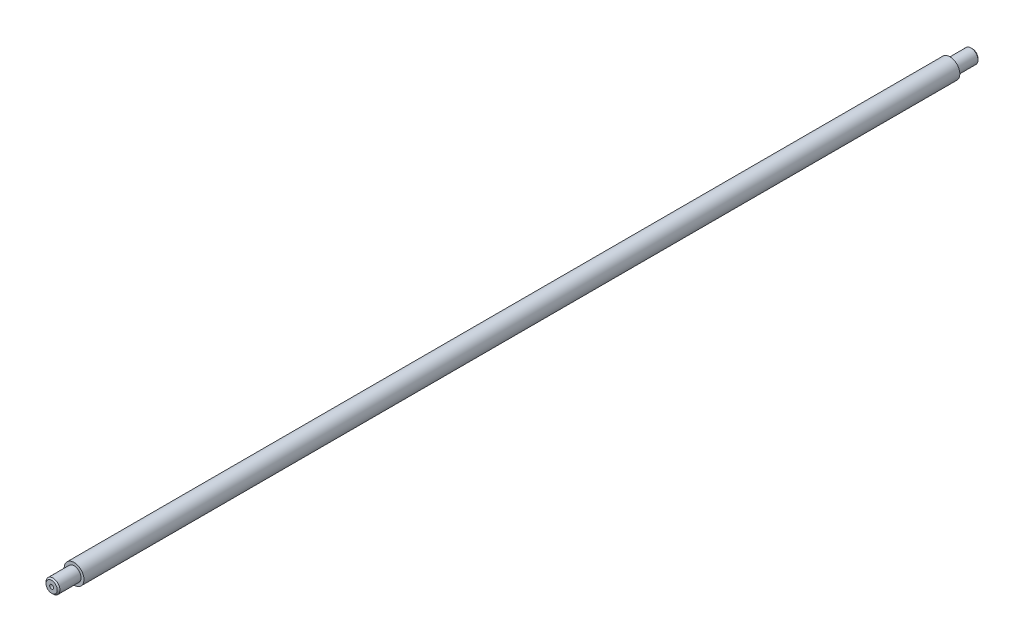
from build123d import *

# Parameters (mm, degrees)
SKETCH2_R           = 5.588
BOSS_EXTRUDE1_DEPTH = 247.65
SKETCH3_R           = 3.937
BOSS_EXTRUDE2_DEPTH = 12.7
BOSS_EXTRUDE3_START = 12.7
SKETCH4_R           = 3.937
BOSS_EXTRUDE3_DEPTH = 12.7
SKETCH5_R           = 1.143
CUT_EXTRUDE1_DEPTH  = 25.4
CUT_EXTRUDE2_START  = -25.4
SKETCH6_R           = 1.143
CUT_EXTRUDE2_DEPTH  = 25.4
CHAMFER2_SIZE       = 0.762


with BuildPart() as part:
    # Sketch2 → Boss-Extrude1 (new, symmetric)
    with BuildSketch(Plane.XY):
        Circle(SKETCH2_R)
    extrude(amount=BOSS_EXTRUDE1_DEPTH, both=True)

    # Sketch3 → Boss-Extrude2 (add)
    with BuildSketch(Plane.XY.offset(247.65)):
        Circle(SKETCH3_R)
    extrude(amount=BOSS_EXTRUDE2_DEPTH)

    # Sketch4 → Boss-Extrude3 (add)
    with BuildSketch(Plane(origin=(0, 0, -247.65), x_dir=(-1, 0, 0), z_dir=(0, 0, -1)).offset(BOSS_EXTRUDE3_START)):
        with Locations(Location((0, 0, 0), (0, 0, 180))):
            Circle(SKETCH4_R)
    extrude(amount=-BOSS_EXTRUDE3_DEPTH)

    # Sketch5 → Cut-Extrude1 (cut)
    with BuildSketch(Plane.XY.offset(260.35)):
        Circle(SKETCH5_R)
    extrude(amount=-CUT_EXTRUDE1_DEPTH, mode=Mode.SUBTRACT)

    # Sketch6 → Cut-Extrude2 (cut)
    with BuildSketch(Plane(origin=(0, 0, -260.35), x_dir=(-1, 0, 0), z_dir=(0, 0, -1)).offset(CUT_EXTRUDE2_START)):
        with Locations(Location((0, 0, 0), (0, 0, 180))):
            Circle(SKETCH6_R)
    extrude(amount=CUT_EXTRUDE2_DEPTH, mode=Mode.SUBTRACT)

    # Chamfer2
    chamfer2_edges = [part.edges().sort_by_distance(p)[0] for p in [
        (-3.937, 0, -260.35),
        (-3.937, 0, 260.35),
    ]]
    chamfer(chamfer2_edges, length=CHAMFER2_SIZE)


solid = part.part
